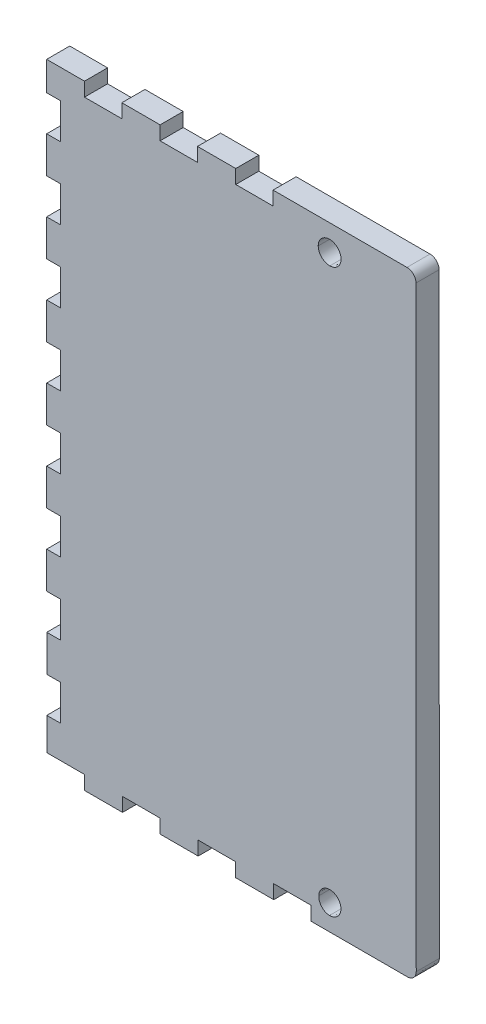
from build123d import *

# Parameters (mm, degrees)
BOSS_EXTRUDE1_DEPTH = 5


with BuildPart() as part:
    # Sketch2 → Boss-Extrude1 (new body)
    with BuildSketch(Plane.XY):
        with BuildLine():
            Line((3.000022, 125.605083), (0, 125.605083))
            Line((0, 125.605083), (0, 131.876887))
            Line((0, 131.876887), (8.190395777, 131.876887))
            Line((8.190395777, 131.876887), (8.190395777, 128.876921))
            Line((8.190395777, 128.876921), (16.281283777, 128.876921))
            Line((16.281283777, 128.876921), (16.281283777, 131.876908))
            Line((16.281283777, 131.876908), (24.572181777, 131.876908))
            Line((24.572181777, 131.876908), (24.572181777, 128.876921))
            Line((24.572181777, 128.876921), (32.663126777, 128.876921))
            Line((32.663126777, 128.876921), (32.663126777, 131.876908))
            Line((32.663126777, 131.876908), (40.954024777, 131.876908))
            Line((40.954024777, 131.876908), (40.954024777, 128.876921))
            Line((40.954024777, 128.876921), (49.032014777, 128.876921))
            Line((49.032014777, 128.876921), (49.032014777, 131.870876))
            Line((49.032014777, 131.870876), (78.034171777, 131.870876))
            add(Edge.make_bspline(
                [(78.034171777, 131.870876), (79.118469777, 131.870876), (79.997507777, 130.991859), (79.998212777, 129.914053)],
                knots=[0, 0, 0, 0, 1, 1, 1, 1], degree=3))
            Line((79.998212777, 129.914053), (80.048932, 0.769332))
            add(Edge.make_bspline(
                [(78.08681, -1.164385), (79.171108, -1.164385), (80.050118, -0.285367), (80.048932, 0.769332)],
                knots=[0, 0, 0, 0, 1, 1, 1, 1], degree=3))
            Line((78.08681, -1.164385), (57.273444, -1.164385))
            Line((57.273444, -1.164385), (57.273444, 1.835025))
            Line((57.273444, 1.835025), (49.182528, 1.835025))
            Line((49.182528, 1.835025), (49.182528, -1.165))
            Line((49.182528, -1.165), (40.904555, -1.165))
            Line((40.904555, -1.165), (40.904555, 1.835025))
            Line((40.904555, 1.835025), (32.813639, 1.835025))
            Line((32.813639, 1.835025), (32.813639, -1.165))
            Line((32.813639, -1.165), (24.522769, -1.165))
            Line((24.522769, -1.165), (24.522769, 1.835025))
            Line((24.522769, 1.835025), (16.431825, 1.835025))
            Line((16.431825, 1.835025), (16.431825, -1.164385))
            Line((16.431825, -1.164385), (8.140926, -1.164385))
            Line((8.140926, -1.164385), (8.140926, 1.835025))
            Line((8.140926, 1.835025), (0.026314406, 1.835025))
            Line((0.026314406, 1.835025), (0.026314406, 8.841283))
            Line((0.026314406, 8.841283), (3.000022, 8.841283))
            Line((3.000022, 8.841283), (3.000022, 16.532191))
            Line((3.000022, 16.532191), (0.026314406, 16.532191))
            Line((0.026314406, 16.532191), (0.026314406, 24.423125))
            Line((0.026314406, 24.423125), (3.000022, 24.423125))
            Line((3.000022, 24.423125), (3.000022, 32.114033))
            Line((3.000022, 32.114033), (0, 32.114033))
            Line((0, 32.114033), (0, 40.004966))
            Line((0, 40.004966), (3.000022, 40.004966))
            Line((3.000022, 40.004966), (3.000022, 47.695875))
            Line((3.000022, 47.695875), (0, 47.695875))
            Line((0, 47.695875), (0, 55.586808))
            Line((0, 55.586808), (3.000022, 55.586808))
            Line((3.000022, 55.586808), (3.000022, 63.277716))
            Line((3.000022, 63.277716), (0, 63.277716))
            Line((0, 63.277716), (0, 71.16865))
            Line((0, 71.16865), (3.000022, 71.16865))
            Line((3.000022, 71.16865), (3.000022, 78.859558))
            Line((3.000022, 78.859558), (0, 78.859558))
            Line((0, 78.859558), (0, 86.750491))
            Line((0, 86.750491), (3.000022, 86.750491))
            Line((3.000022, 86.750491), (3.000022, 94.4414))
            Line((3.000022, 94.4414), (0, 94.4414))
            Line((0, 94.4414), (0, 102.332333))
            Line((0, 102.332333), (3.000022, 102.332333))
            Line((3.000022, 102.332333), (3.000022, 110.023241))
            Line((3.000022, 110.023241), (0, 110.023241))
            Line((0, 110.023241), (0, 117.914175))
            Line((0, 117.914175), (3.000022, 117.914175))
            Line((3.000022, 117.914175), (3.000022, 125.605083))
        make_face()
        with BuildLine():
            add(Edge.make_bspline(
                [(58.942475583, 4.45705786), (58.876355433, 3.116936717), (59.910031097, 1.976908278), (61.249001885, 1.910844885)],
                knots=[0, 0, 0, 0, 1, 1, 1, 1], degree=3))
            add(Edge.make_bspline(
                [(61.249001885, 1.910844885), (62.61708533, 1.904036469), (63.733535737, 3.008514398), (63.740350017, 4.377776229)],
                knots=[0, 0, 0, 0, 1, 1, 1, 1], degree=3))
            add(Edge.make_bspline(
                [(63.740350017, 4.377776229), (63.747057434, 5.712148161), (62.669459301, 6.79974011), (61.335720144, 6.806444347)],
                knots=[0, 0, 0, 0, 1, 1, 1, 1], degree=3))
            add(Edge.make_bspline(
                [(61.335720144, 6.806444347), (60.026995423, 6.818478401), (58.95451532, 5.766400599), (58.942475583, 4.45705786)],
                knots=[0, 0, 0, 0, 1, 1, 1, 1], degree=3))
        make_face(mode=Mode.SUBTRACT)
        with BuildLine():
            add(Edge.make_bspline(
                [(58.81372287, 126.294450328), (58.82088208, 124.91026836), (59.949710178, 123.793975081), (61.332703971, 123.801128146)],
                knots=[0, 0, 0, 0, 1, 1, 1, 1], degree=3))
            add(Edge.make_bspline(
                [(61.332703971, 123.801128146), (62.683823094, 123.814309965), (63.770278691, 124.921256436), (63.757085518, 126.273539334)],
                knots=[0, 0, 0, 0, 1, 1, 1, 1], degree=3))
            add(Edge.make_bspline(
                [(63.757085518, 126.273539334), (63.749960977, 127.651200571), (62.626009819, 128.762672593), (61.249001885, 128.755551431)],
                knots=[0, 0, 0, 0, 1, 1, 1, 1], degree=3))
            add(Edge.make_bspline(
                [(61.249001885, 128.755551431), (59.897851275, 128.748355096), (58.806523136, 127.646238991), (58.81372287, 126.294450328)],
                knots=[0, 0, 0, 0, 1, 1, 1, 1], degree=3))
        make_face(mode=Mode.SUBTRACT)
    extrude(amount=BOSS_EXTRUDE1_DEPTH)


solid = part.part
